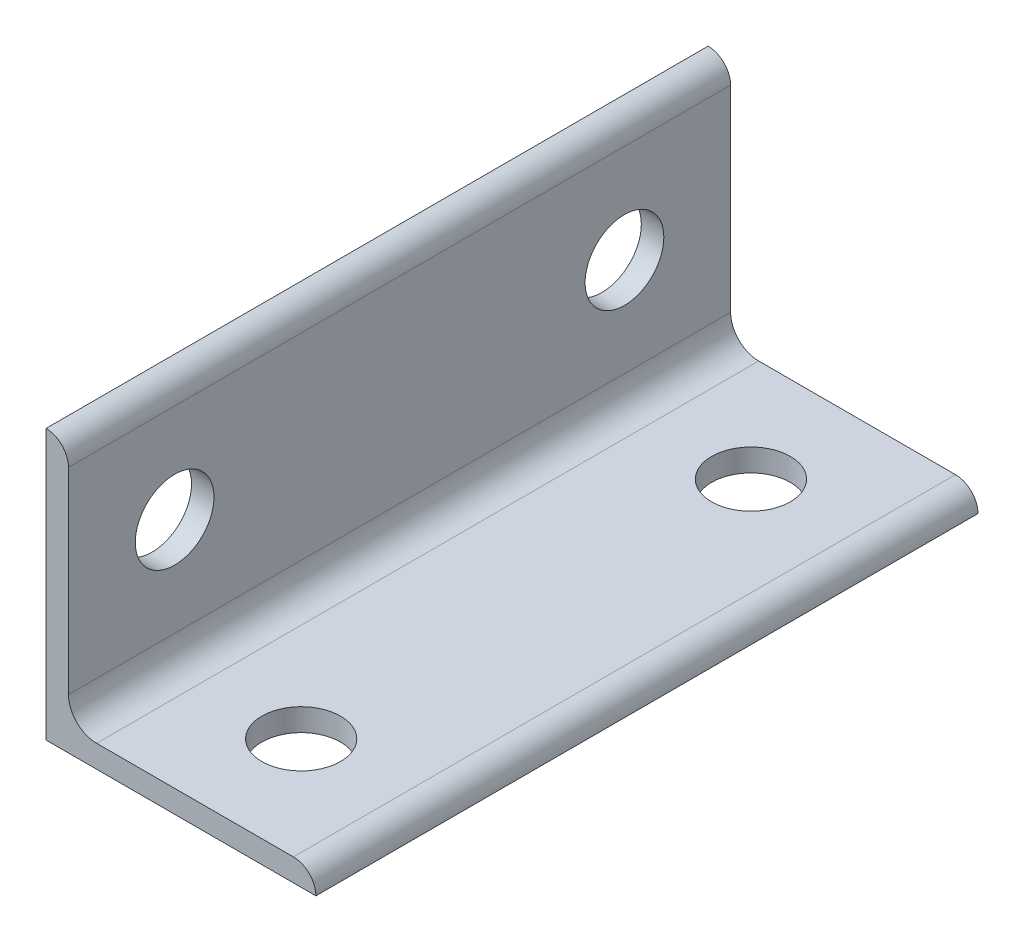
from build123d import *

# Parameters (mm, degrees)
BOSS_EXTRUDE1_DEPTH = 186.944
CUT_EXTRUDE1_REACH  = 215.62
SKETCH2_R           = 11.1125
CUT_EXTRUDE2_REACH  = 207.171
SKETCH3_R           = 11.1125


with BuildPart() as part:
    # Sketch1 → Boss-Extrude1 (new body)
    with BuildSketch(Plane.XY):
        with BuildLine():
            Line((-47.62501925, 0), (-47.62501925, 76.2))
            ThreePointArc((-47.62501925, 76.2), (-43.134891189, 74.340128061), (-41.27501925, 69.85))
            Line((-41.27501925, 69.85), (-41.27501925, 14.2875))
            ThreePointArc((-41.27501925, 14.2875), (-38.950179326, 8.674839924), (-33.33751925, 6.35))
            Line((-33.33751925, 6.35), (22.22498075, 6.35))
            ThreePointArc((22.22498075, 6.35), (26.715108811, 4.490128061), (28.57498075, 0))
            Line((28.57498075, 0), (-47.62501925, 0))
        make_face()
    extrude(amount=-BOSS_EXTRUDE1_DEPTH)

    # Sketch2 → Cut-Extrude1 (cut, up to next)
    with BuildSketch(Plane(origin=(-41.27501925, 0, 0), x_dir=(0, 0, -1), z_dir=(1, 0, 0)), mode=Mode.PRIVATE) as cut_extrude1_sk1:
        with Locations((156.972, 42.06875)):
            Circle(SKETCH2_R)
    cut_extrude1_tool1 = extrude(cut_extrude1_sk1.sketch, amount=-CUT_EXTRUDE1_REACH, mode=Mode.PRIVATE) & part.part
    # Sketch2 → Cut-Extrude1 (cut, up to next)
    with BuildSketch(Plane(origin=(-41.27501925, 0, 0), x_dir=(0, 0, -1), z_dir=(1, 0, 0)), mode=Mode.PRIVATE) as cut_extrude1_sk2:
        with Locations((29.972, 42.06875)):
            Circle(SKETCH2_R)
    cut_extrude1_tool2 = extrude(cut_extrude1_sk2.sketch, amount=-CUT_EXTRUDE1_REACH, mode=Mode.PRIVATE) & part.part
    add(cut_extrude1_tool1.solids().sort_by_distance((-41.275019, 42.06875, -156.972))[0], mode=Mode.SUBTRACT)
    add(cut_extrude1_tool2.solids().sort_by_distance((-41.275019, 42.06875, -29.972))[0], mode=Mode.SUBTRACT)

    # Sketch3 → Cut-Extrude2 (cut, up to next)
    with BuildSketch(Plane(origin=(0, 6.35, 0), x_dir=(1, 0, 0), z_dir=(0, 1, 0)), mode=Mode.PRIVATE) as cut_extrude2_sk1:
        with Locations(Location((-5.55626925, 156.972, 0), (0, 0, 180))):
            Circle(SKETCH3_R)
    cut_extrude2_tool1 = extrude(cut_extrude2_sk1.sketch, amount=-CUT_EXTRUDE2_REACH, mode=Mode.PRIVATE) & part.part
    # Sketch3 → Cut-Extrude2 (cut, up to next)
    with BuildSketch(Plane(origin=(0, 6.35, 0), x_dir=(1, 0, 0), z_dir=(0, 1, 0)), mode=Mode.PRIVATE) as cut_extrude2_sk2:
        with Locations(Location((-5.55626925, 29.972, 0), (0, 0, 180))):
            Circle(SKETCH3_R)
    cut_extrude2_tool2 = extrude(cut_extrude2_sk2.sketch, amount=-CUT_EXTRUDE2_REACH, mode=Mode.PRIVATE) & part.part
    add(cut_extrude2_tool1.solids().sort_by_distance((-5.556269, 6.35, -156.972))[0], mode=Mode.SUBTRACT)
    add(cut_extrude2_tool2.solids().sort_by_distance((-5.556269, 6.35, -29.972))[0], mode=Mode.SUBTRACT)


solid = part.part
